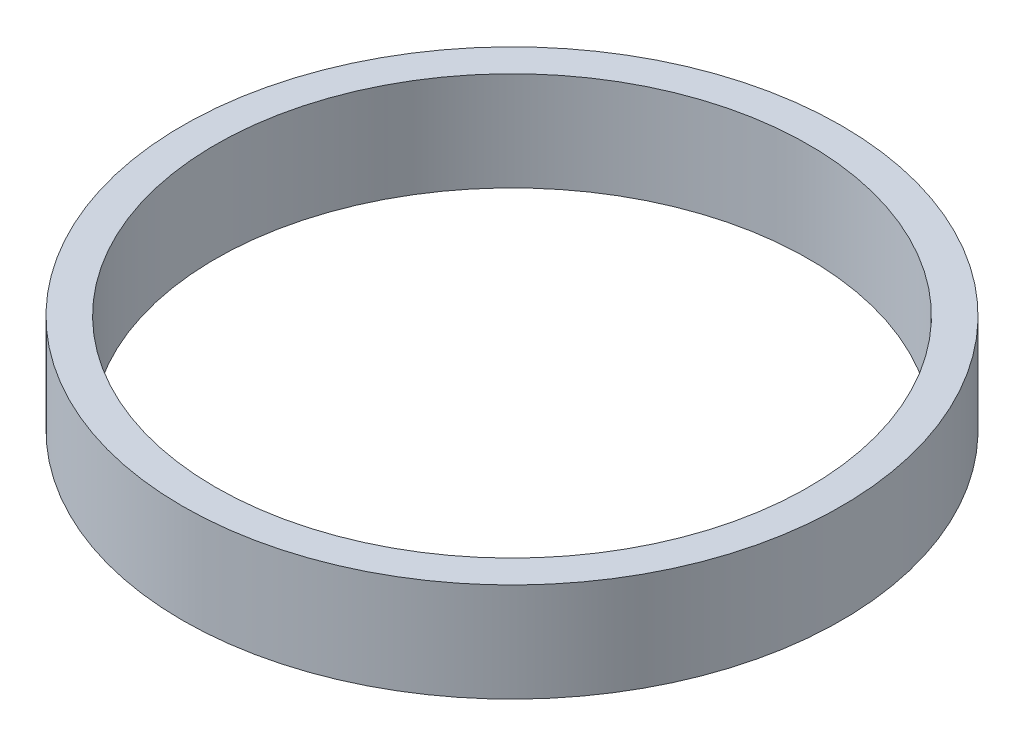
from build123d import *

# Parameters (mm, degrees)
SKETCH1_R           = 10
BOSS_EXTRUDE1_DEPTH = 3
SKETCH2_R           = 9
CUT_EXTRUDE1_DEPTH  = 3


with BuildPart() as part:
    # Sketch1 → Boss-Extrude1 (new body)
    with BuildSketch(Plane(origin=(0, 0, 0), x_dir=(1, 0, 0), z_dir=(0, 1, 0))):
        with Locations(Location((0, 0, 0), (0, 0, 270))):
            Circle(SKETCH1_R)
    extrude(amount=BOSS_EXTRUDE1_DEPTH)

    # Sketch2 → Cut-Extrude1 (cut)
    with BuildSketch(Plane(origin=(0, 3, 0), x_dir=(1, 0, 0), z_dir=(0, 1, 0))):
        with Locations(Location((0, 0, 0), (0, 0, 270))):
            Circle(SKETCH2_R)
    extrude(amount=-CUT_EXTRUDE1_DEPTH, mode=Mode.SUBTRACT)


solid = part.part
